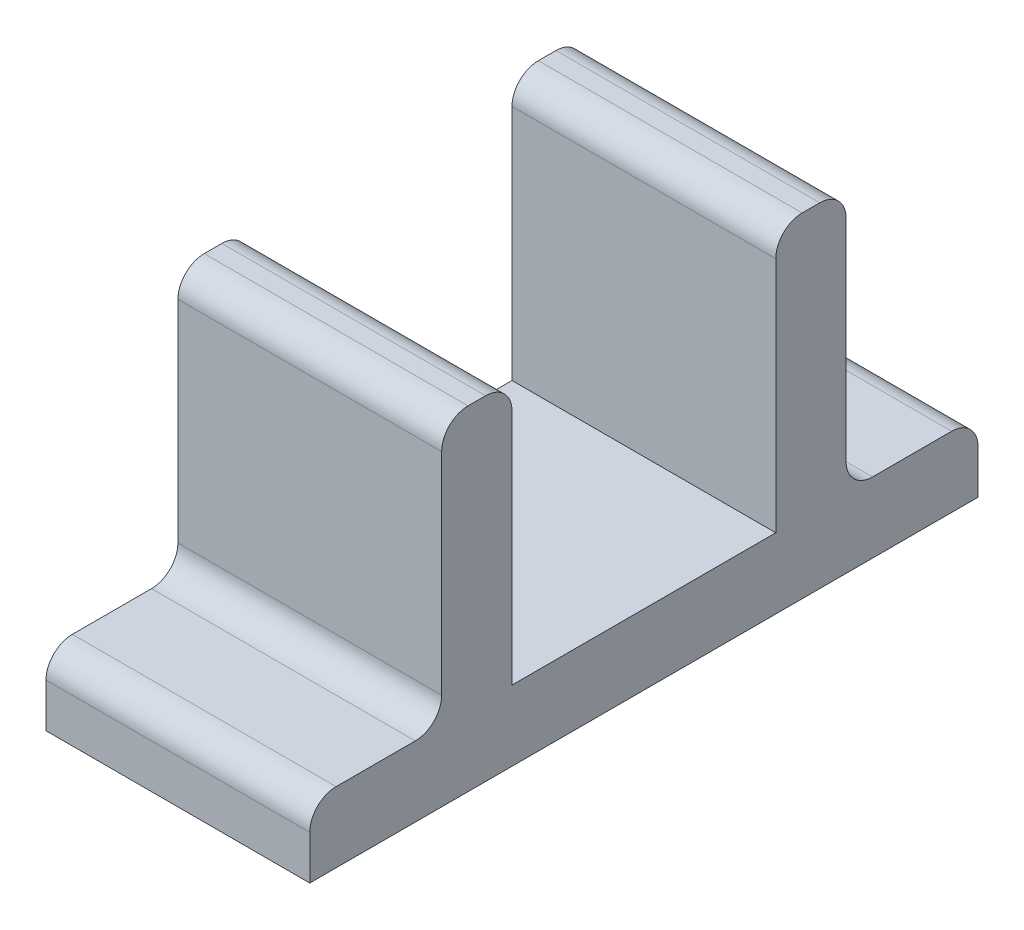
from build123d import *

# Parameters (mm, degrees)
BOSS_EXTRUDE2_DEPTH = 30
FILLET1_R           = 3


with BuildPart() as part:
    # Sketch1 → Boss-Extrude2 (new body)
    with BuildSketch(Plane(origin=(0, 0, 0), x_dir=(0, 0, -1), z_dir=(1, 0, 0))):
        Polygon((0, 8), (0, 38), (8, 38), (8, 8), (38, 8), (38, 38), (46, 38), (46, 8), (61, 8), (61, 0), (-15, 0), (-15, 8), align=None)
    extrude(amount=BOSS_EXTRUDE2_DEPTH)

    # Fillet1
    fillet1_edges = [part.edges().sort_by_distance(p)[0] for p in [
        (15, 8, 15),
        (15, 8, 0),
        (15, 38, 0),
        (15, 38, -8),
        (15, 38, -38),
        (15, 38, -46),
        (15, 8, -46),
        (15, 8, -61),
    ]]
    fillet(fillet1_edges, radius=FILLET1_R)


solid = part.part
